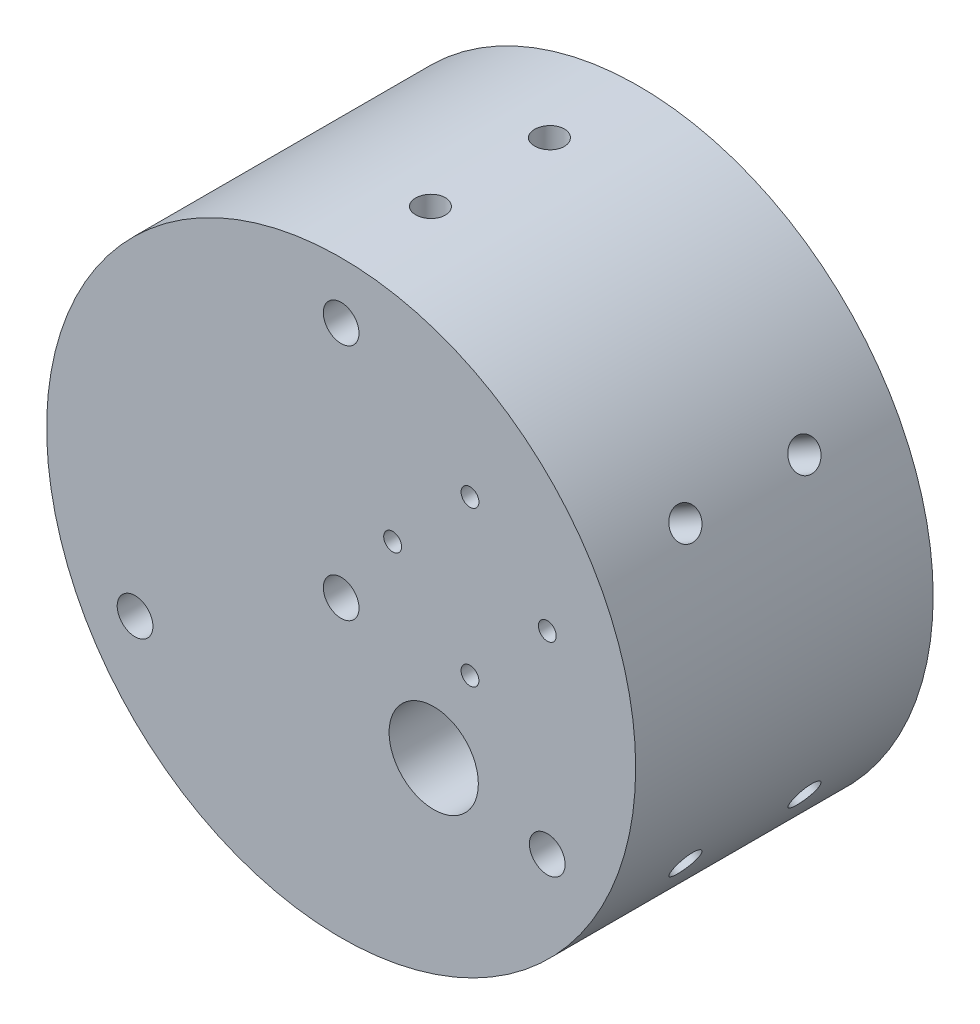
from build123d import *

# Parameters (mm, degrees)
SKETCH1_R           = 49.5
BOSS_EXTRUDE1_DEPTH = 50
SKETCH2_R           = 3
CUT_EXTRUDE1_DEPTH  = 87.026158812
SKETCH6_R           = 1.5
CUT_EXTRUDE2_DEPTH  = 10
SKETCH7_R           = 7.5
CUT_EXTRUDE3_DEPTH  = 87.026158812
SKETCH8_R           = 2.5
CUT_EXTRUDE4_DEPTH  = 10
CIRPATTERN1_COUNT   = 6
SKETCH9_R           = 2.5
CUT_EXTRUDE5_DEPTH  = 10
CIRPATTERN2_COUNT   = 6


with BuildPart() as part:
    # Sketch1 → Boss-Extrude1 (new body)
    with BuildSketch(Plane.XY):
        Circle(SKETCH1_R)
    extrude(amount=BOSS_EXTRUDE1_DEPTH)

    # Sketch2 → Cut-Extrude1 (cut, through all)
    with BuildSketch(Plane.XY.offset(50)):
        with Locations((0, 40)):
            Circle(SKETCH2_R)
        with Locations((34.641016151, -20)):
            Circle(SKETCH2_R)
        with Locations((-34.641016151, -20)):
            Circle(SKETCH2_R)
        Circle(SKETCH2_R)
    extrude(amount=-CUT_EXTRUDE1_DEPTH, mode=Mode.SUBTRACT)

    # Sketch6 → Cut-Extrude2 (cut)
    with BuildSketch(Plane.XY.offset(50)):
        with Locations((21.650635095, 25.5)):
            Circle(SKETCH6_R)
        with Locations((34.650635095, 12.5)):
            Circle(SKETCH6_R)
        with Locations((21.650635095, -0.5)):
            Circle(SKETCH6_R)
        with Locations((8.650635095, 12.5)):
            Circle(SKETCH6_R)
    extrude(amount=-CUT_EXTRUDE2_DEPTH, mode=Mode.SUBTRACT)

    # Sketch7 → Cut-Extrude3 (cut, through all)
    with BuildSketch(Plane.XY.offset(50)):
        with Locations((15.556349186, -15.556349186)):
            Circle(SKETCH7_R)
    extrude(amount=-CUT_EXTRUDE3_DEPTH, mode=Mode.SUBTRACT)

    # Sketch8 → Cut-Extrude4 (cut)
    with BuildSketch(Plane(origin=(0, -49.5, 0), x_dir=(-1, 0, 0), z_dir=(0, -1, 0))):
        with Locations(Location((0, -35, 0), (0, 0, 90))):
            Circle(SKETCH8_R)
    cut_extrude4 = extrude(amount=-CUT_EXTRUDE4_DEPTH, mode=Mode.SUBTRACT)

    # CirPattern1: Cut-Extrude4 ×6 about axis
    cirpattern1_axis = Axis((0, 0, 0), (0, 0, 1))
    for i in range(1, CIRPATTERN1_COUNT):
        add(cut_extrude4.rotate(cirpattern1_axis, i * 360 / CIRPATTERN1_COUNT), mode=Mode.SUBTRACT)

    # Sketch9 → Cut-Extrude5 (cut)
    with BuildSketch(Plane(origin=(0, -49.5, 0), x_dir=(-1, 0, 0), z_dir=(0, -1, 0))):
        with Locations(Location((0, -15, 0), (0, 0, 90))):
            Circle(SKETCH9_R)
    cut_extrude5 = extrude(amount=-CUT_EXTRUDE5_DEPTH, mode=Mode.SUBTRACT)

    # CirPattern2: Cut-Extrude5 ×6 about axis
    cirpattern2_axis = Axis((0, 0, 0), (0, 0, 1))
    for i in range(1, CIRPATTERN2_COUNT):
        add(cut_extrude5.rotate(cirpattern2_axis, i * 360 / CIRPATTERN2_COUNT), mode=Mode.SUBTRACT)


solid = part.part
